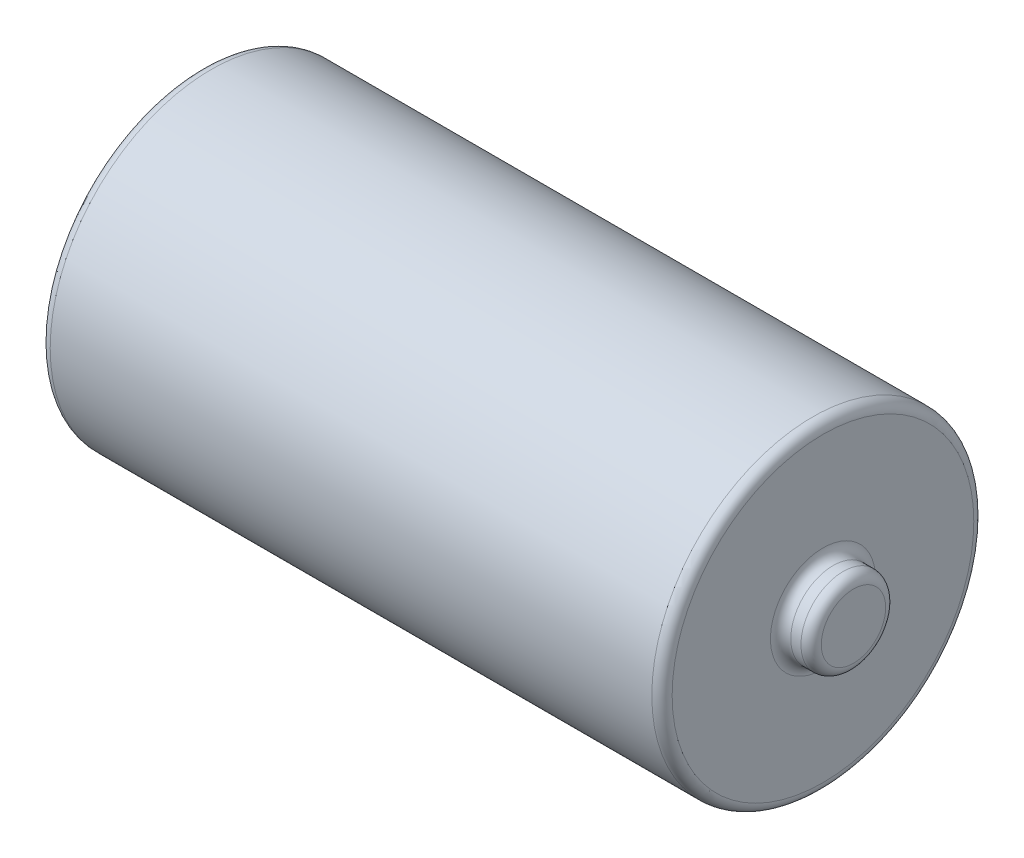
from build123d import *

# Parameters (mm, degrees)
SKETCH1_R           = 12.065
BOSS_EXTRUDE1_DEPTH = 23.3045
SKETCH2_W           = 2.286
SKETCH2_H           = 3.175
FILLET2_R           = 0.762
FILLET3_R           = 0.762


with BuildPart() as part:
    # Sketch1 → Boss-Extrude1 (new, symmetric)
    with BuildSketch(Plane(origin=(0, 0, 0), x_dir=(0, 0, -1), z_dir=(1, 0, 0))):
        Circle(SKETCH1_R)
    extrude(amount=BOSS_EXTRUDE1_DEPTH, both=True)

    # Sketch2 → Revolve1 (revolve)
    with BuildSketch(Plane.XY, mode=Mode.PRIVATE) as revolve1_sk:
        with Locations((24.4475, 1.5875)):
            Rectangle(SKETCH2_W, SKETCH2_H)
    revolve(revolve1_sk.sketch.rotate(Axis((23.3045, 0, 0), (-1, 0, 0)), 90), axis=Axis((23.3045, 0, 0), (-1, 0, 0)))

    # Fillet2
    fillet2_edges = [part.edges().sort_by_distance(p)[0] for p in [
        (23.3045, 0, 3.175),
        (25.5905, 0, 3.175),
    ]]
    fillet(fillet2_edges, radius=FILLET2_R)

    # Fillet3
    fillet3_edges = [part.edges().sort_by_distance(p)[0] for p in [
        (-23.3045, 0, 12.065),
        (23.3045, 0, 12.065),
    ]]
    fillet(fillet3_edges, radius=FILLET3_R)


solid = part.part
